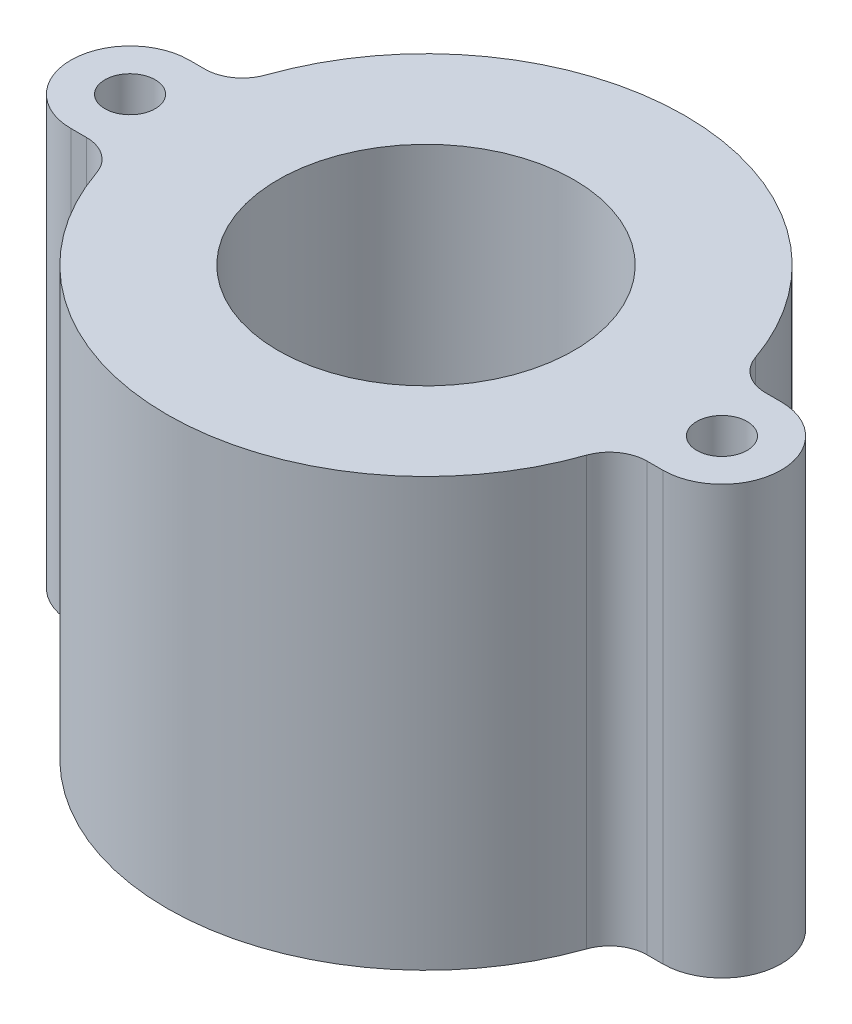
from build123d import *

# Parameters (mm, degrees)
BOSS_EXTRUDE1_DEPTH  = 28.9
FILLET1_R            = 2.54
M3_CLEARANCE_HOLE1_D = 3.4


with BuildPart() as part:
    # Sketch1 → Boss-Extrude1 (new body)
    with BuildSketch(Plane(origin=(0, 0, 0), x_dir=(1, 0, 0), z_dir=(0, 1, 0))):
        with BuildLine():
            Line((9.16515139, 4), (17.036725037, 4))
            ThreePointArc((17.036725037, 4), (0, 17.5), (-17.036725037, 4))
            Line((-17.036725037, 4), (-9.16515139, 4))
            ThreePointArc((-9.16515139, 4), (0, 10), (9.16515139, 4))
        make_face()
        with BuildLine():
            Line((9.16515139, -4), (17.036725037, -4))
            ThreePointArc((17.036725037, -4), (17.383795445, -2.013369296), (17.5, 0))
            ThreePointArc((17.5, 0), (17.383795445, 2.013369296), (17.036725037, 4))
            Line((17.036725037, 4), (9.16515139, 4))
            ThreePointArc((9.16515139, 4), (9.789063129, 2.043096437), (10, 0))
            ThreePointArc((10, 0), (9.789063129, -2.043096437), (9.16515139, -4))
        make_face()
        with BuildLine():
            ThreePointArc((-17.036725037, 4), (-17.5, 0), (-17.036725037, -4))
            Line((-17.036725037, -4), (-9.16515139, -4))
            ThreePointArc((-9.16515139, -4), (-10, 0), (-9.16515139, 4))
            Line((-9.16515139, 4), (-17.036725037, 4))
        make_face()
        with BuildLine():
            ThreePointArc((-17.036725037, -4), (0, -17.5), (17.036725037, -4))
            Line((17.036725037, -4), (9.16515139, -4))
            ThreePointArc((9.16515139, -4), (0, -10), (-9.16515139, -4))
            Line((-9.16515139, -4), (-17.036725037, -4))
        make_face()
        with BuildLine():
            Line((17.036725037, -4), (20, -4))
            Line((20, -4), (20, 4))
            Line((20, 4), (17.036725037, 4))
            ThreePointArc((17.036725037, 4), (17.383795445, 2.013369296), (17.5, 0))
            ThreePointArc((17.5, 0), (17.383795445, -2.013369296), (17.036725037, -4))
        make_face()
        with BuildLine():
            ThreePointArc((20, 4), (24, 0), (20, -4))
            Line((20, -4), (20, 4))
        make_face()
        with BuildLine():
            Line((-20, -4), (-20, 4))
            ThreePointArc((-20, 4), (-24, 0), (-20, -4))
        make_face()
        with BuildLine():
            Line((-20, -4), (-17.036725037, -4))
            ThreePointArc((-17.036725037, -4), (-17.5, 0), (-17.036725037, 4))
            Line((-17.036725037, 4), (-20, 4))
            Line((-20, 4), (-20, -4))
        make_face()
    extrude(amount=BOSS_EXTRUDE1_DEPTH)

    # Fillet1
    fillet1_edges = [part.edges().sort_by_distance(p)[0] for p in [
        (-17.036725037, 14.45, 4),
        (-17.036725037, 14.45, -4),
        (17.036725037, 14.45, -4),
        (17.036725037, 14.45, 4),
    ]]
    fillet(fillet1_edges, radius=FILLET1_R)

    # M3 Clearance Hole1 (through all)
    with Locations(Plane(origin=(0, 28.9, 0), x_dir=(1, 0, 0), z_dir=(0, 1, 0))):
        with Locations((-20, 0), (20, 0)):
            Hole(M3_CLEARANCE_HOLE1_D / 2)


solid = part.part
